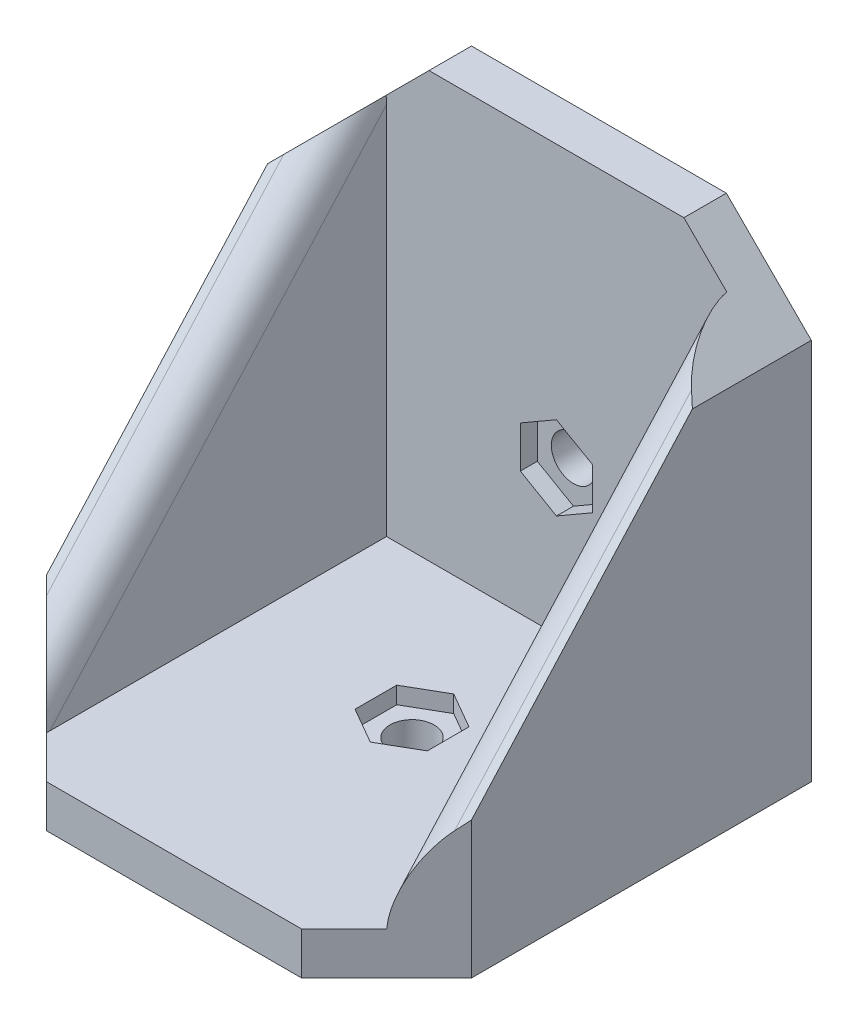
from build123d import *

# Parameters (mm, degrees)
SKETCH1_W               = 50
SKETCH1_H               = 50
BOSS_EXTRUDE1_DEPTH     = 5
SKETCH2_W               = 50
SKETCH2_H               = 5
BOSS_EXTRUDE2_DEPTH     = 50
SKETCH3_R               = 2.6
CUT_EXTRUDE1_DEPTH      = 50
SKETCH4_R               = 2.6
CUT_EXTRUDE2_DEPTH      = 50
CHAMFER1_SIZE           = 10
CUT_EXTRUDE3_DEPTH      = 2
CUT_EXTRUDE4_DEPTH      = 2
BOSS_EXTRUDE3_DEPTH     = 5
BOSS_EXTRUDE4_START     = -50
BOSS_EXTRUDE4_DEPTH     = 5
CUT_EXTRUDE5_DEPTH      = 66.383484153
CUT_EXTRUDE5_DEPTH_BACK = 66.383484153
CUT_EXTRUDE6_DEPTH      = 79.421935707
CUT_EXTRUDE6_DEPTH_BACK = 79.421935707
FILLET1_R               = 4


with BuildPart() as part:
    # Sketch1 → Boss-Extrude1 (new body)
    with BuildSketch(Plane(origin=(0, 0, 0), x_dir=(1, 0, 0), z_dir=(0, 1, 0))):
        Rectangle(SKETCH1_W, SKETCH1_H)
    extrude(amount=BOSS_EXTRUDE1_DEPTH)

    # Sketch2 → Boss-Extrude2 (add)
    with BuildSketch(Plane(origin=(0, 5, 0), x_dir=(1, 0, 0), z_dir=(0, 1, 0))):
        with Locations((0, 22.5)):
            Rectangle(SKETCH2_W, SKETCH2_H)
    extrude(amount=BOSS_EXTRUDE2_DEPTH)

    # Sketch3 → Cut-Extrude1 (cut)
    with BuildSketch(Plane.XY.offset(-20)):
        with Locations((0, 22)):
            Circle(SKETCH3_R)
    extrude(amount=-CUT_EXTRUDE1_DEPTH, mode=Mode.SUBTRACT)

    # Sketch4 → Cut-Extrude2 (cut)
    with BuildSketch(Plane(origin=(0, 5, 0), x_dir=(1, 0, 0), z_dir=(0, 1, 0))):
        with Locations(Location((0, 3, 0), (0, 0, 270))):
            Circle(SKETCH4_R)
    extrude(amount=-CUT_EXTRUDE2_DEPTH, mode=Mode.SUBTRACT)

    # Chamfer1
    chamfer1_edges = [part.edges().sort_by_distance(p)[0] for p in [
        (25, 55, -22.5),
        (-25, 55, -22.5),
        (25, 2.5, 25),
        (-25, 2.5, 25),
    ]]
    chamfer(chamfer1_edges, length=CHAMFER1_SIZE)

    # Sketch5 → Cut-Extrude3 (cut)
    with BuildSketch(Plane.XY.offset(-20)):
        Polygon((0, 26.907477288), (-4.25, 24.453738644), (-4.25, 19.546261356), (0, 17.092522712), (4.25, 19.546261356), (4.25, 24.453738644), align=None)
    extrude(amount=-CUT_EXTRUDE3_DEPTH, mode=Mode.SUBTRACT)

    # Sketch6 → Cut-Extrude4 (cut)
    with BuildSketch(Plane(origin=(0, 5, 0), x_dir=(1, 0, 0), z_dir=(0, 1, 0))):
        Polygon((0, 7.907477288), (-4.25, 5.453738644), (-4.25, 0.546261356), (0, -1.907477288), (4.25, 0.546261356), (4.25, 5.453738644), align=None)
    extrude(amount=-CUT_EXTRUDE4_DEPTH, mode=Mode.SUBTRACT)

    # Sketch7 → Boss-Extrude3 (add)
    with BuildSketch(Plane.ZY.offset(25)):
        Polygon((-20, 55), (25, 5), (-20, 5), align=None)
    extrude(amount=-BOSS_EXTRUDE3_DEPTH)

    # Sketch7<2> → Boss-Extrude4 (add)
    with BuildSketch(Plane.ZY.offset(25).offset(BOSS_EXTRUDE4_START)):
        Polygon((-20, 55), (25, 5), (-20, 5), align=None)
    extrude(amount=BOSS_EXTRUDE4_DEPTH)

    # Sketch8 → Cut-Extrude5 (cut, two sides: drawn at the far end of the back side and taken through both)
    with BuildSketch(Plane.XZ.offset(-CUT_EXTRUDE5_DEPTH_BACK)):
        Polygon((-25, 15), (-15, 25), (15, 25), (25, 15), (34.688631102, 13.868509335), (41.480658752, 39.43849578), (-8.141096193, 43.673524785), (-46.895606899, 41.556010282), (-45.565833038, 17.218639636), (-29.396147425, 9.154043084), align=None)
    extrude(amount=CUT_EXTRUDE5_DEPTH + CUT_EXTRUDE5_DEPTH_BACK, mode=Mode.SUBTRACT)

    # Sketch9 → Cut-Extrude6 (cut, two sides: drawn at the far end of the back side and taken through both)
    with BuildSketch(Plane(origin=(0, 0, -25), x_dir=(-1, 0, 0), z_dir=(0, 0, -1)).offset(-CUT_EXTRUDE6_DEPTH_BACK)):
        Polygon((-25, 45), (-15, 55), (15, 55), (25, 45), (34.215912108, 41.57366901), (36.332651021, 61.374461749), (-31.078246872, 63.763955814), (-33.631649738, 52.638414759), (-28.038481557, 40.053786352), align=None)
    extrude(amount=CUT_EXTRUDE6_DEPTH + CUT_EXTRUDE6_DEPTH_BACK, mode=Mode.SUBTRACT)

    # Fillet1
    fillet1_edges = [part.edges().sort_by_distance(p)[0] for p in [
        (20, 30.277777778, 2.25),
        (-20, 30.277777778, 2.25),
    ]]
    fillet(fillet1_edges, radius=FILLET1_R)


solid = part.part
